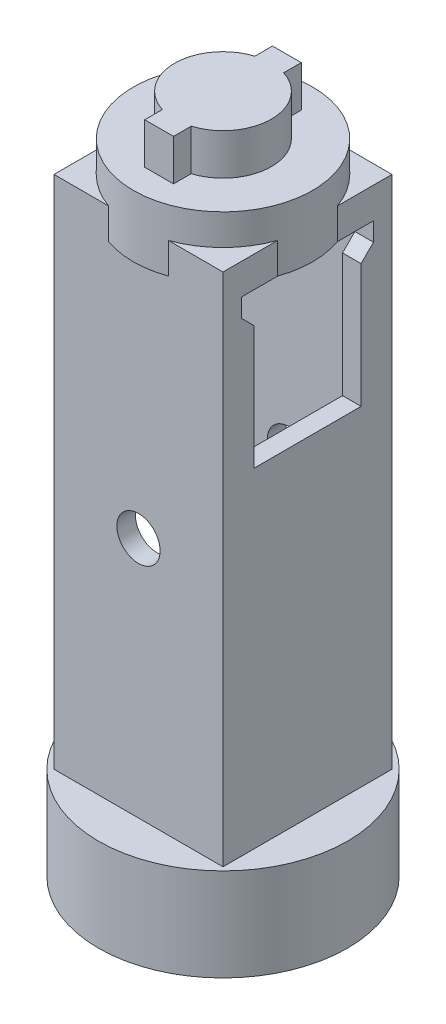
from build123d import *

# Parameters (mm, degrees)
BOSS_EXTRUDE1_DEPTH = 6.66
BOSS_EXTRUDE2_START = 10
SKETCH3_R           = 14.5
BOSS_EXTRUDE2_DEPTH = 10
BOSS_EXTRUDE3_START = -5
SKETCH5_W           = 27.34
SKETCH5_H           = 27.34
SKETCH5_W_2         = 21.34
SKETCH5_H_2         = 21.34
BOSS_EXTRUDE3_DEPTH = 83.34
SKETCH6_W           = 21.34
SKETCH6_H           = 21.34
BOSS_EXTRUDE4_DEPTH = 5
SKETCH8_W           = 21.34
SKETCH8_H           = 78.34
CUT_EXTRUDE1_DEPTH  = 5
SKETCH9_W           = 21.34
SKETCH9_H           = 3
CUT_EXTRUDE2_DEPTH  = 5
SKETCH10_W          = 27.34
SKETCH10_H          = 27.34
BOSS_EXTRUDE5_DEPTH = 3
SKETCH11_R          = 20.15
BOSS_EXTRUDE6_DEPTH = 12
SKETCH12_R          = 16.15
CUT_EXTRUDE3_DEPTH  = 10.5
SKETCH13_R          = 12.15
CUT_EXTRUDE4_DEPTH  = 0.5
BOSS_EXTRUDE7_START = 3
BOSS_EXTRUDE7_DEPTH = 3
SKETCH19_R          = 3.5
CUT_EXTRUDE5_DEPTH  = 112.972606961
SKETCH20_W          = 17.34
SKETCH20_H          = 20
CUT_EXTRUDE6_DEPTH  = 111.983314599
CUT_EXTRUDE7_DEPTH  = 111.983314599


with BuildPart() as part:
    # Sketch2 → Boss-Extrude1 (new body)
    with BuildSketch(Plane(origin=(0, 0, 0), x_dir=(1, 0, 0), z_dir=(0, 1, 0))):
        with BuildLine():
            Line((-4.257926427, 13.560157214), (-4.257926427, -1.390428058))
            ThreePointArc((-4.257926427, -1.390428058), (-0.281073012, 1.444552088), (1.242073573, 6.084864578))
            ThreePointArc((1.242073573, 6.084864578), (-0.281073012, 10.725177067), (-4.257926427, 13.560157214))
        make_face()
        with BuildLine():
            Line((-8.917926427, 13.560157214), (-8.917926427, -1.390428058))
            ThreePointArc((-8.917926427, -1.390428058), (-6.587926427, -1.745135422), (-4.257926427, -1.390428058))
            Line((-4.257926427, -1.390428058), (-4.257926427, 13.560157214))
            ThreePointArc((-4.257926427, 13.560157214), (-6.587926427, 13.914864578), (-8.917926427, 13.560157214))
        make_face()
        with BuildLine():
            Line((-8.917926427, -1.390428058), (-8.917926427, -4.245135422))
            Line((-8.917926427, -4.245135422), (-4.257926427, -4.245135422))
            Line((-4.257926427, -4.245135422), (-4.257926427, -1.390428058))
            ThreePointArc((-4.257926427, -1.390428058), (-6.587926427, -1.745135422), (-8.917926427, -1.390428058))
        make_face()
        with BuildLine():
            ThreePointArc((-8.917926427, 13.560157214), (-14.417926427, 6.084864578), (-8.917926427, -1.390428058))
            Line((-8.917926427, -1.390428058), (-8.917926427, 13.560157214))
        make_face()
        with BuildLine():
            Line((-8.917926427, 16.414864578), (-8.917926427, 13.560157214))
            ThreePointArc((-8.917926427, 13.560157214), (-6.587926427, 13.914864578), (-4.257926427, 13.560157214))
            Line((-4.257926427, 13.560157214), (-4.257926427, 16.414864578))
            Line((-4.257926427, 16.414864578), (-8.917926427, 16.414864578))
        make_face()
    extrude(amount=BOSS_EXTRUDE1_DEPTH)

    # Sketch3 → Boss-Extrude2 (add)
    # profile 1 of 3: a face of its own
    with BuildSketch(Plane.XZ.offset(BOSS_EXTRUDE2_START)):
        with Locations(Location((-6.587926427, -6.084864578, 0), (0, 0, 270))):
            Circle(SKETCH3_R)
        with BuildLine():
            ThreePointArc((-4.257926427, -13.560157214), (1.242073573, -6.084864578), (-4.257926427, 1.390428058))
            Line((-4.257926427, 1.390428058), (-4.257926427, 4.245135422))
            Line((-4.257926427, 4.245135422), (-8.917926427, 4.245135422))
            Line((-8.917926427, 4.245135422), (-8.917926427, 1.390428058))
            ThreePointArc((-8.917926427, 1.390428058), (-14.417926427, -6.084864578), (-8.917926427, -13.560157214))
            Line((-8.917926427, -13.560157214), (-8.917926427, -16.414864578))
            Line((-8.917926427, -16.414864578), (-4.257926427, -16.414864578))
            Line((-4.257926427, -16.414864578), (-4.257926427, -13.560157214))
        make_face(mode=Mode.SUBTRACT)
    # profile 2 of 3: a face of its own
    with BuildSketch(Plane.XZ.offset(BOSS_EXTRUDE2_START)):
        with BuildLine():
            Line((-4.257926427, 4.245135422), (-6.587926427, 4.245135422))
            Line((-6.587926427, 4.245135422), (-6.587926427, -16.414864578))
            Line((-6.587926427, -16.414864578), (-4.257926427, -16.414864578))
            Line((-4.257926427, -16.414864578), (-4.257926427, -13.560157214))
            ThreePointArc((-4.257926427, -13.560157214), (1.242073573, -6.084864578), (-4.257926427, 1.390428058))
            Line((-4.257926427, 1.390428058), (-4.257926427, 4.245135422))
        make_face()
    # profile 3 of 3: a face of its own
    with BuildSketch(Plane.XZ.offset(BOSS_EXTRUDE2_START)):
        with BuildLine():
            Line((-6.587926427, -16.414864578), (-6.587926427, 4.245135422))
            Line((-6.587926427, 4.245135422), (-8.917926427, 4.245135422))
            Line((-8.917926427, 4.245135422), (-8.917926427, 1.390428058))
            ThreePointArc((-8.917926427, 1.390428058), (-14.417926427, -6.084864578), (-8.917926427, -13.560157214))
            Line((-8.917926427, -13.560157214), (-8.917926427, -16.414864578))
            Line((-8.917926427, -16.414864578), (-6.587926427, -16.414864578))
        make_face()
    extrude(amount=-BOSS_EXTRUDE2_DEPTH)

    # Sketch5 → Boss-Extrude3 (add)
    with BuildSketch(Plane.XZ.offset(10).offset(BOSS_EXTRUDE3_START)):
        with Locations((-6.587926427, -6.084864578)):
            Rectangle(SKETCH5_W, SKETCH5_H)
        with Locations((-6.587926427, -6.084864578)):
            Rectangle(SKETCH5_W_2, SKETCH5_H_2, mode=Mode.SUBTRACT)
    extrude(amount=BOSS_EXTRUDE3_DEPTH)

    # Sketch6 → Boss-Extrude4 (add)
    with BuildSketch(Plane.XZ.offset(10)):
        with Locations((-6.587926427, -6.084864578)):
            Rectangle(SKETCH6_W, SKETCH6_H)
    extrude(amount=-BOSS_EXTRUDE4_DEPTH)

    # Sketch8 → Cut-Extrude1 (cut)
    with BuildSketch(Plane.ZY.offset(20.257926427)):
        with Locations((-6.084864578, -49.17)):
            Rectangle(SKETCH8_W, SKETCH8_H)
    extrude(amount=-CUT_EXTRUDE1_DEPTH, mode=Mode.SUBTRACT)

    # Sketch9 → Cut-Extrude2 (cut)
    with BuildSketch(Plane.ZY.offset(-4.082073573)):
        with Locations((-6.084864578, -11.5)):
            Rectangle(SKETCH9_W, SKETCH9_H)
    extrude(amount=-CUT_EXTRUDE2_DEPTH, mode=Mode.SUBTRACT)

    # Sketch10 → Boss-Extrude5 (add)
    with BuildSketch(Plane.XZ.offset(88.34)):
        with Locations((-6.587926427, -6.084864578)):
            Rectangle(SKETCH10_W, SKETCH10_H)
    extrude(amount=BOSS_EXTRUDE5_DEPTH)

    # Sketch11 → Boss-Extrude6 (add)
    with BuildSketch(Plane(origin=(0, -91.34, 0), x_dir=(-1, 0, 0), z_dir=(0, -1, 0))):
        with Locations(Location((6.587926427, 6.084864578, 0), (0, 0, 90))):
            Circle(SKETCH11_R)
    extrude(amount=BOSS_EXTRUDE6_DEPTH)

    # Sketch12 → Cut-Extrude3 (cut)
    with BuildSketch(Plane.XZ.offset(103.34)):
        with Locations(Location((-6.587926427, -6.084864578, 0), (0, 0, 270))):
            Circle(SKETCH12_R)
    extrude(amount=-CUT_EXTRUDE3_DEPTH, mode=Mode.SUBTRACT)

    # Sketch13 → Cut-Extrude4 (cut)
    with BuildSketch(Plane.XZ.offset(92.84)):
        with Locations(Location((-6.587926427, -6.084864578, 0), (0, 0, 270))):
            Circle(SKETCH13_R)
    extrude(amount=-CUT_EXTRUDE4_DEPTH, mode=Mode.SUBTRACT)

    # Sketch14 → Boss-Extrude7 (add)
    with BuildSketch(Plane(origin=(0, -91.34, 0), x_dir=(1, 0, 0), z_dir=(0, 1, 0)).offset(BOSS_EXTRUDE7_START)):
        with BuildLine():
            Line((-6.587926427, -7.585135422), (-6.587926427, -14.065135422))
            ThreePointArc((-6.587926427, -14.065135422), (7.660275213, -8.163337063), (13.562073573, 6.084864578))
            ThreePointArc((13.562073573, 6.084864578), (7.660275213, 20.333066219), (-6.587926427, 26.234864578))
            Line((-6.587926427, 26.234864578), (-6.587926427, 19.754864578))
            Line((-6.587926427, 19.754864578), (7.082073573, 19.754864578))
            Line((7.082073573, 19.754864578), (7.082073573, -7.585135422))
            Line((7.082073573, -7.585135422), (-6.587926427, -7.585135422))
        make_face()
        with BuildLine():
            ThreePointArc((-6.587926427, 26.234864578), (-26.737926427, 6.084864578), (-6.587926427, -14.065135422))
            Line((-6.587926427, -14.065135422), (-6.587926427, -7.585135422))
            Line((-6.587926427, -7.585135422), (-20.257926427, -7.585135422))
            Line((-20.257926427, -7.585135422), (-20.257926427, 19.754864578))
            Line((-20.257926427, 19.754864578), (-6.587926427, 19.754864578))
            Line((-6.587926427, 19.754864578), (-6.587926427, 26.234864578))
        make_face()
    extrude(amount=-BOSS_EXTRUDE7_DEPTH)

    # Sketch19 → Cut-Extrude5 (cut, through all)
    with BuildSketch(Plane.XY.offset(7.585135422)):
        with Locations((-6.587926427, -49.17)):
            Circle(SKETCH19_R)
    extrude(amount=-CUT_EXTRUDE5_DEPTH, mode=Mode.SUBTRACT)

    # Sketch20 → Cut-Extrude6 (cut, through all)
    with BuildSketch(Plane.ZY.offset(-4.082073573)):
        with Locations((-6.084864578, -25)):
            Rectangle(SKETCH20_W, SKETCH20_H)
    extrude(amount=-CUT_EXTRUDE6_DEPTH, mode=Mode.SUBTRACT)

    # Sketch21 → Cut-Extrude7 (cut, through all)
    with BuildSketch(Plane.ZY.offset(-4.082073573)):
        Polygon((-14.754864578, -15), (-16.754864578, -13), (4.585135422, -13), (2.585135422, -15), align=None)
    extrude(amount=-CUT_EXTRUDE7_DEPTH, mode=Mode.SUBTRACT)


solid = part.part
